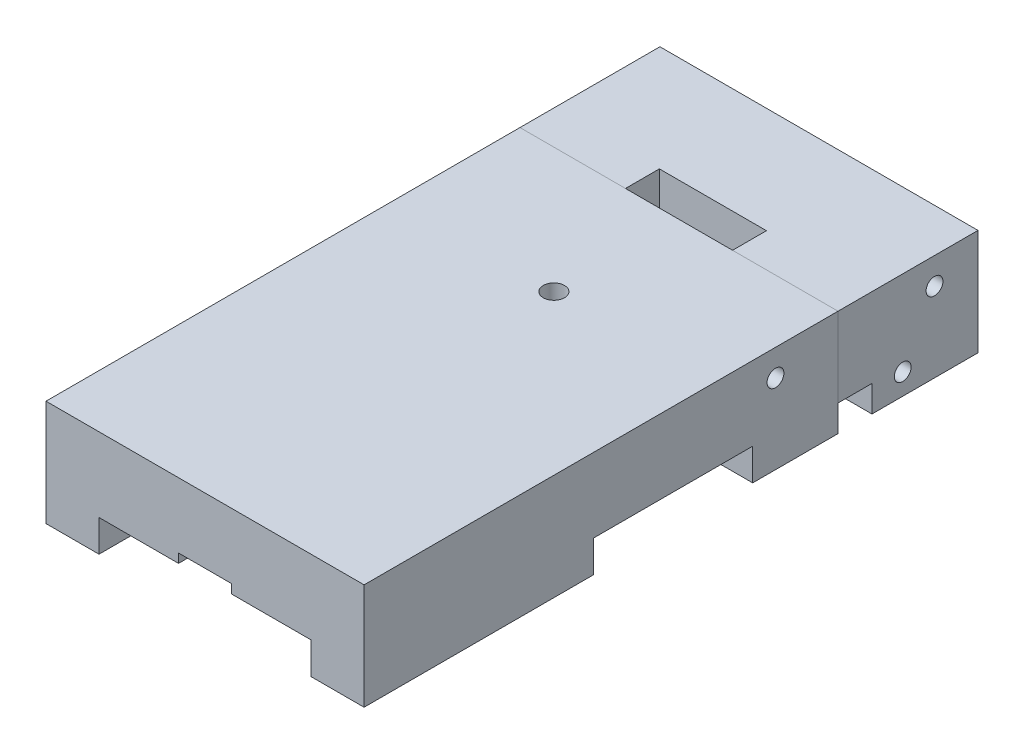
from build123d import *

# Parameters (mm, degrees)
BOSS_EXTRUDE1_DEPTH         = 12.7
BOSS_EXTRUDE1_DEPTH_BACK    = 12.7
SKETCH1_W                   = 76.2
SKETCH1_H                   = 147.066
SKETCH2_R                   = 4.7625
CUT_EXTRUDE1_DEPTH          = 25.4
CUT_EXTRUDE2_DEPTH          = 7.62
CUT_EXTRUDE4_DEPTH          = 84.785452729
CUT_EXTRUDE4_DEPTH_BACK     = 84.785452729
SKETCH5_W                   = 25.654
SKETCH5_H                   = 8.128
F_1_4_20_TAPPED_HOLE1_D     = 5.1054
F_1_4_20_TAPPED_HOLE1_DEPTH = 19.05
F_1_4_20_TAPPED_HOLE1_TIP   = 1.533816902
SKETCH9_R                   = 1.59639
F_8_32_TAPPED_HOLE_DEPTH    = 12.7
CUT_EXTRUDE7_DEPTH          = 2.159
SKETCH12_R                  = 2.0193
CUT_EXTRUDE8_DEPTH          = 12.7
SKETCH13_W                  = 25.273
SKETCH13_H                  = 8.128
CUT_EXTRUDE9_DEPTH          = 6.35
SKETCH15_R                  = 2.0193
CUT_EXTRUDE11_DEPTH         = 57.15
SKETCH17_R                  = 4.2164
CUT_EXTRUDE12_DEPTH         = 5.461
SKETCH19_R                  = 2.0193
CUT_EXTRUDE14_DEPTH         = 12.7
CUT_EXTRUDE16_DEPTH         = 2.286
CUT_EXTRUDE18_DEPTH         = 11.176
F_10_32_TAPPED_HOLE1_D      = 4.0386
F_10_32_TAPPED_HOLE1_DEPTH  = 14.1224
F_10_32_TAPPED_HOLE1_TIP    = 1.213317848


with BuildPart() as part:
    # Sketch1 → Boss-Extrude1 (new, two sides: drawn at the far end of the back side and taken through both)
    with BuildSketch(Plane(origin=(0, 0, 0), x_dir=(1, 0, 0), z_dir=(0, 1, 0)).offset(-BOSS_EXTRUDE1_DEPTH_BACK)):
        Rectangle(SKETCH1_W, SKETCH1_H)
    extrude(amount=BOSS_EXTRUDE1_DEPTH + BOSS_EXTRUDE1_DEPTH_BACK)

    # Sketch2 → Cut-Extrude1 (cut)
    with BuildSketch(Plane(origin=(0, 0, -73.533), x_dir=(-1, 0, 0), z_dir=(0, 0, -1))):
        with Locations((0, -12.7)):
            Circle(SKETCH2_R)
    extrude(amount=-CUT_EXTRUDE1_DEPTH, mode=Mode.SUBTRACT)

    # Sketch3 → Cut-Extrude2 (cut)
    with BuildSketch(Plane(origin=(0, -12.7, 0), x_dir=(-1, 0, 0), z_dir=(0, -1, 0))):
        with BuildLine():
            Line((10.922, 19.558), (44.45, 19.558))
            Line((44.45, 19.558), (44.45, -18.542))
            Line((44.45, -18.542), (25.4, -18.542))
            Line((25.4, -18.542), (25.4, -76.708))
            ThreePointArc((25.4, -76.708), (23.540128061, -81.198128061), (19.05, -83.058))
            Line((19.05, -83.058), (-19.05, -83.058))
            ThreePointArc((-19.05, -83.058), (-23.540128061, -81.198128061), (-25.4, -76.708))
            Line((-25.4, -76.708), (-25.4, -18.542))
            Line((-25.4, -18.542), (-44.45, -18.542))
            Line((-44.45, -18.542), (-44.45, 19.558))
            Line((-44.45, 19.558), (-10.922, 19.558))
            Line((-10.922, 19.558), (-10.922, 40.005))
            Line((-10.922, 40.005), (10.922, 40.005))
            Line((10.922, 40.005), (10.922, 19.558))
        make_face()
    extrude(amount=-CUT_EXTRUDE2_DEPTH, mode=Mode.SUBTRACT)

    # Sketch5 → Cut-Extrude4 (cut, two sides: drawn at the far end of the back side and taken through both)
    with BuildSketch(Plane(origin=(0, 0, 0), x_dir=(1, 0, 0), z_dir=(0, 1, 0)).offset(-CUT_EXTRUDE4_DEPTH_BACK)):
        with Locations((0, 44.069)):
            Rectangle(SKETCH5_W, SKETCH5_H)
    extrude(amount=CUT_EXTRUDE4_DEPTH + CUT_EXTRUDE4_DEPTH_BACK, mode=Mode.SUBTRACT)

    # 1/4-20 Tapped Hole1
    with Locations(Plane(origin=(-11.034450397, 12.7, 14.547513529), x_dir=(-1, 0, 0), z_dir=(0, 1, 0))):
        with Locations((-11.034450397, -24.580513529)):
            Hole(F_1_4_20_TAPPED_HOLE1_D / 2, depth=F_1_4_20_TAPPED_HOLE1_DEPTH)
            with Locations((0, 0, -(F_1_4_20_TAPPED_HOLE1_DEPTH + F_1_4_20_TAPPED_HOLE1_TIP / 2))):  # 118° drill point
                Cone(0, F_1_4_20_TAPPED_HOLE1_D / 2, F_1_4_20_TAPPED_HOLE1_TIP, mode=Mode.SUBTRACT)

    # Sketch9 → 8-32 Tapped Hole (cut)
    with BuildSketch(Plane(origin=(0, -12.7, 0), x_dir=(-1, 0, 0), z_dir=(0, -1, 0))):
        with Locations((31.75, 29.083)):
            Circle(SKETCH9_R)
        with Locations((31.75, -28.067)):
            Circle(SKETCH9_R)
        with Locations((-31.75, -28.067)):
            Circle(SKETCH9_R)
        with Locations((-31.75, 29.083)):
            Circle(SKETCH9_R)
    extrude(amount=-F_8_32_TAPPED_HOLE_DEPTH, mode=Mode.SUBTRACT)

    # Sketch11 → Cut-Extrude7 (cut)
    with BuildSketch(Plane(origin=(0, -5.08, 0), x_dir=(-1, 0, 0), z_dir=(0, -1, 0))):
        with BuildLine():
            Line((0.00254, -32.893), (-0.00254, -32.893))
            ThreePointArc((-0.00254, -32.893), (-4.490872009, -34.752127991), (-6.35, -39.24046))
            Line((-6.35, -39.24046), (-6.35, -73.533))
            Line((-6.35, -73.533), (6.35, -73.533))
            Line((6.35, -73.533), (6.35, -39.24046))
            ThreePointArc((6.35, -39.24046), (4.490872009, -34.752127991), (0.00254, -32.893))
        make_face()
    extrude(amount=-CUT_EXTRUDE7_DEPTH, mode=Mode.SUBTRACT)

    # Sketch12 → Cut-Extrude8 (cut)
    with BuildSketch(Plane.XZ.offset(5.08)):
        with Locations((12.7, 54.483)):
            Circle(SKETCH12_R)
        with Locations((-12.7, 54.483)):
            Circle(SKETCH12_R)
    extrude(amount=-CUT_EXTRUDE8_DEPTH, mode=Mode.SUBTRACT)

    # Sketch13 → Cut-Extrude9 (cut)
    with BuildSketch(Plane.XZ.offset(12.7)):
        with Locations((25.4635, -44.069)):
            Rectangle(SKETCH13_W, SKETCH13_H)
    extrude(amount=-CUT_EXTRUDE9_DEPTH, mode=Mode.SUBTRACT)

    # Sketch15 → Cut-Extrude11 (cut)
    with BuildSketch(Plane(origin=(0, 0, -73.533), x_dir=(-1, 0, 0), z_dir=(0, 0, -1))):
        with Locations((-24.13, 0)):
            Circle(SKETCH15_R)
        with Locations((24.13, 0)):
            Circle(SKETCH15_R)
    extrude(amount=-CUT_EXTRUDE11_DEPTH, mode=Mode.SUBTRACT)

    # Sketch17 → Cut-Extrude12 (cut)
    with BuildSketch(Plane(origin=(0, 0, -73.533), x_dir=(-1, 0, 0), z_dir=(0, 0, -1))):
        with Locations((-24.13, 0)):
            Circle(SKETCH17_R)
        with Locations((24.13, 0)):
            Circle(SKETCH17_R)
    extrude(amount=-CUT_EXTRUDE12_DEPTH, mode=Mode.SUBTRACT)

    # Sketch19 → Cut-Extrude14 (cut)
    with BuildSketch(Plane.XZ.offset(12.7)):
        with Locations((-31.75, -57.658)):
            Circle(SKETCH19_R)
        with Locations((-12.7, -57.658)):
            Circle(SKETCH19_R)
    extrude(amount=-CUT_EXTRUDE14_DEPTH, mode=Mode.SUBTRACT)

    # Sketch22 → Cut-Extrude16 (cut)
    with BuildSketch(Plane.XZ.offset(12.7)):
        with BuildLine():
            Line((-12.7, -35.90925), (12.7, -35.90925))
            ThreePointArc((12.7, -35.90925), (13.49375, -35.1155), (12.7, -34.32175))
            Line((12.7, -34.32175), (-12.7, -34.32175))
            ThreePointArc((-12.7, -34.32175), (-13.49375, -35.1155), (-12.7, -35.90925))
        make_face()
        with BuildLine():
            Line((-12.7, -23.65375), (12.7, -23.65375))
            ThreePointArc((12.7, -23.65375), (13.49375, -24.4475), (12.7, -25.24125))
            Line((12.7, -25.24125), (-12.7, -25.24125))
            ThreePointArc((-12.7, -25.24125), (-13.49375, -24.4475), (-12.7, -23.65375))
        make_face()
    extrude(amount=-CUT_EXTRUDE16_DEPTH, mode=Mode.SUBTRACT)

    # Sketch23 → Cut-Extrude18 (cut)
    with BuildSketch(Plane.XZ.offset(12.7)):
        with BuildLine():
            Line((-10.922, -40.005), (10.922, -40.005))
            Line((10.922, -40.005), (10.922, -22.733))
            ThreePointArc((10.922, -22.733), (9.99206403, -20.48793597), (7.747, -19.558))
            Line((7.747, -19.558), (-7.747, -19.558))
            ThreePointArc((-7.747, -19.558), (-9.99206403, -20.48793597), (-10.922, -22.733))
            Line((-10.922, -22.733), (-10.922, -40.005))
        make_face()
    extrude(amount=-CUT_EXTRUDE18_DEPTH, mode=Mode.SUBTRACT)

    # #10-32 Tapped Hole1
    with Locations(Plane(origin=(38.1, 0, 0), x_dir=(0, 0, -1), z_dir=(1, 0, 0))):
        with Locations((63.119, 6.35), (55.499, -7.62), (25.019, 6.35)):
            Hole(F_10_32_TAPPED_HOLE1_D / 2, depth=F_10_32_TAPPED_HOLE1_DEPTH)
            with Locations((0, 0, -(F_10_32_TAPPED_HOLE1_DEPTH + F_10_32_TAPPED_HOLE1_TIP / 2))):  # 118° drill point
                Cone(0, F_10_32_TAPPED_HOLE1_D / 2, F_10_32_TAPPED_HOLE1_TIP, mode=Mode.SUBTRACT)


with BuildPart() as body_2:
    # Split1: the piece on the far side of the plane
    add(part.part)
    split(bisect_by=Plane(origin=(0, 0, -40.005), x_dir=(-1, 0, 0), z_dir=(0, 0, -1)), keep=Keep.BOTTOM)


with BuildPart() as part_1:
    add(part.part)

    # Split1
    split(bisect_by=Plane(origin=(0, 0, -40.005), x_dir=(-1, 0, 0), z_dir=(0, 0, -1)), keep=Keep.TOP)


solid = Compound([body_2.part, part_1.part])
